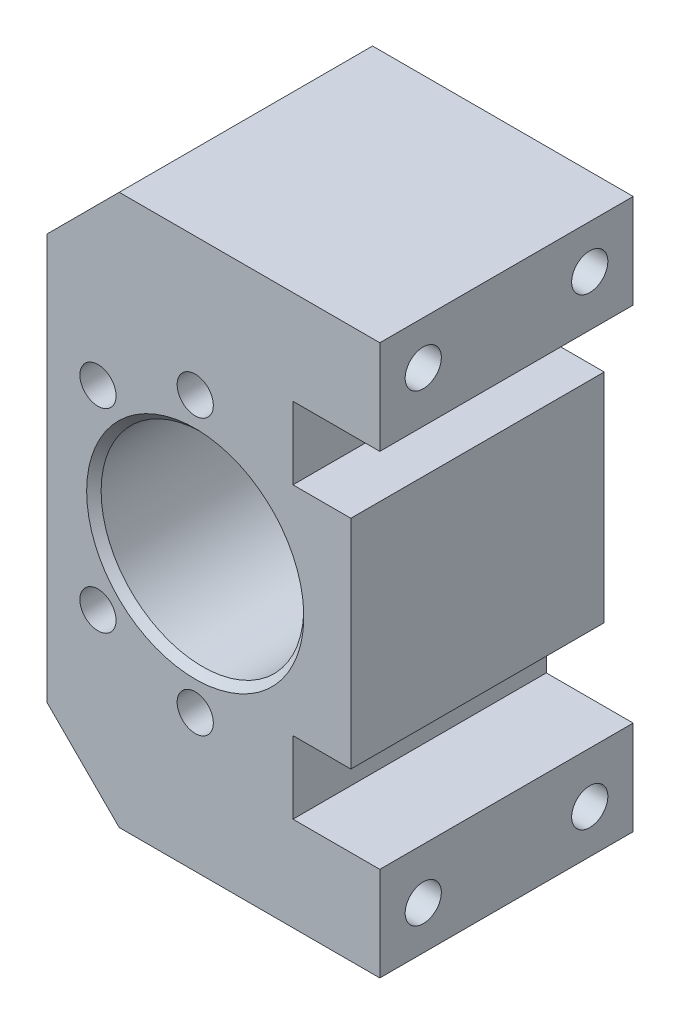
from build123d import *

# Parameters (mm, degrees)
SZKIC1_W                       = 46
SZKIC1_H                       = 76
SZKIC1_R                       = 14
DODANIE_WYCI_GNI_CIE1_DEPTH    = 35
SFAZOWANIE1_SIZE               = 1
OTW_R_GWINTOWANY_M6X1_01_D     = 5
OTW_R_GWINTOWANY_M6X1_01_DEPTH = 17
OTW_R_GWINTOWANY_M6X1_01_TIP   = 1.502151548
OTW_R_GWINTOWANY_M6X1_03_D     = 5
OTW_R_GWINTOWANY_M6X1_03_DEPTH = 17
OTW_R_GWINTOWANY_M6X1_03_TIP   = 1.502151548
SFAZOWANIE2_SIZE               = 10
WYTNIJ_WYCI_GNI_CIE1_DEPTH     = 96.482982777


with BuildPart() as part:
    # Szkic1 → Dodanie-wyciągnięcie1 (new body)
    with BuildSketch(Plane.XY):
        with Locations((23, 38)):
            Rectangle(SZKIC1_W, SZKIC1_H)
        with Locations((20.5, 38)):
            Circle(SZKIC1_R, mode=Mode.SUBTRACT)
    extrude(amount=DODANIE_WYCI_GNI_CIE1_DEPTH)

    # Sfazowanie1
    sfazowanie1_edges = [part.edges().sort_by_distance(p)[0] for p in [
        (6.5, 38, 0),
        (6.5, 38, 35),
    ]]
    chamfer(sfazowanie1_edges, length=SFAZOWANIE1_SIZE)

    # Otwór gwintowany M6x1.01
    with Locations(Plane.XY.offset(35)):
        with Locations((20.5, 57), (7.064971157, 51.435028843), (7.064971157, 24.564971157), (20.5, 19)):
            Hole(OTW_R_GWINTOWANY_M6X1_01_D / 2, depth=OTW_R_GWINTOWANY_M6X1_01_DEPTH)
            with Locations((0, 0, -(OTW_R_GWINTOWANY_M6X1_01_DEPTH + OTW_R_GWINTOWANY_M6X1_01_TIP / 2))):  # 118° drill point
                Cone(0, OTW_R_GWINTOWANY_M6X1_01_D / 2, OTW_R_GWINTOWANY_M6X1_01_TIP, mode=Mode.SUBTRACT)

    # Otwór gwintowany M6x1.03
    with Locations(Plane(origin=(46, 0, 0), x_dir=(0, 0, -1), z_dir=(1, 0, 0))):
        with Locations((-29, 70), (-6, 70), (-6, 6), (-29, 6)):
            Hole(OTW_R_GWINTOWANY_M6X1_03_D / 2, depth=OTW_R_GWINTOWANY_M6X1_03_DEPTH)
            with Locations((0, 0, -(OTW_R_GWINTOWANY_M6X1_03_DEPTH + OTW_R_GWINTOWANY_M6X1_03_TIP / 2))):  # 118° drill point
                Cone(0, OTW_R_GWINTOWANY_M6X1_03_D / 2, OTW_R_GWINTOWANY_M6X1_03_TIP, mode=Mode.SUBTRACT)

    # Sfazowanie2
    sfazowanie2_edges = [part.edges().sort_by_distance(p)[0] for p in [
        (0, 76, 17.5),
        (0, 0, 17.5),
    ]]
    chamfer(sfazowanie2_edges, length=SFAZOWANIE2_SIZE)

    # Szkic10 → Wytnij-wyciągnięcie1 (cut, through all)
    with BuildSketch(Plane(origin=(0, 0, 0), x_dir=(-1, 0, 0), z_dir=(0, 0, -1))):
        Polygon((-46, 13), (-46, 63), (-34, 63), (-34, 53), (-42, 53), (-42, 23), (-34, 23), (-34, 13), align=None)
    extrude(amount=-WYTNIJ_WYCI_GNI_CIE1_DEPTH, mode=Mode.SUBTRACT)


solid = part.part
